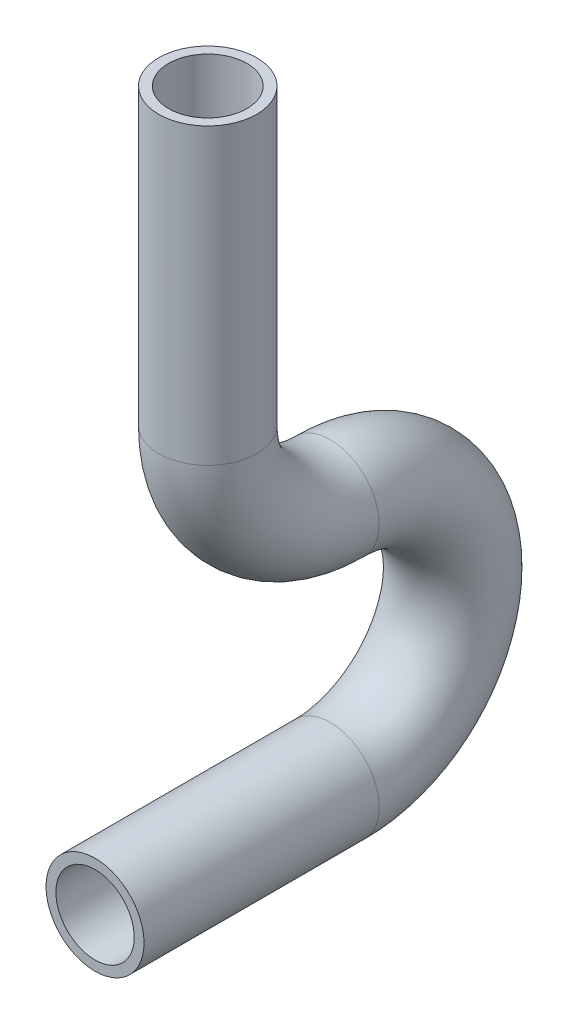
from build123d import *

# Parameters (mm, degrees)
SKETCH2_R           = 25
SKETCH2_R_2         = 20
BASE_EXTRUDE_DEPTH  = 120
SKETCH4_R           = 25
SKETCH4_R_2         = 20
SKETCH5_R           = 25
SKETCH5_R_2         = 20
SKETCH7_R           = 25
SKETCH7_R_2         = 20
BOSS_EXTRUDE1_DEPTH = 150


with BuildPart() as part:
    # Sketch2 → Base-Extrude (new body)
    with BuildSketch(Plane.XY):
        with Locations((-2.499935409, 0.01741759)):
            Circle(SKETCH2_R)
        with Locations((-2.499935409, 0.01741759)):
            Circle(SKETCH2_R_2, mode=Mode.SUBTRACT)
    extrude(amount=-BASE_EXTRUDE_DEPTH)

    # Boss-Sweep1: sweep along a path in Sketch3
    with BuildLine(Plane(origin=(0, 0, 0), x_dir=(0, 0, -1), z_dir=(1, 0, 0))) as boss_sweep1_path:
        ThreePointArc((120, 0.01741759), (182.5, 62.51741759), (120, 125.01741759))
    # Sketch4 → Boss-Sweep1 (sweep)
    with BuildSketch(Plane(origin=(0, 0, -120), x_dir=(-1, 0, 0), z_dir=(0, 0, -1))):
        with Locations((2.499935409, 0.01741759)):
            Circle(SKETCH4_R)
        with Locations((2.499935409, 0.01741759)):
            Circle(SKETCH4_R_2, mode=Mode.SUBTRACT)
    sweep(path=boss_sweep1_path.line)

    # Boss-Sweep2: sweep along a path in Sketch6
    with BuildLine(Plane(origin=(0, 0, 0), x_dir=(0, 0, -1), z_dir=(1, 0, 0))) as boss_sweep2_path:
        ThreePointArc((57.5, 187.51741759), (75.805826176, 143.323243766), (120, 125.01741759))
    # Sketch5 → Boss-Sweep2 (sweep)
    with BuildSketch(Plane.XY.offset(-120)):
        with Locations((-2.499935409, 125.01741759)):
            Circle(SKETCH5_R)
        with Locations((-2.499935409, 125.01741759)):
            Circle(SKETCH5_R_2, mode=Mode.SUBTRACT)
    sweep(path=boss_sweep2_path.line)

    # Sketch7 → Boss-Extrude1 (add)
    with BuildSketch(Plane(origin=(0, 187.51741759, 0), x_dir=(-1, 0, 0), z_dir=(0, 1, 0))):
        with Locations((2.499935409, -57.5)):
            Circle(SKETCH7_R)
        with Locations((2.499935409, -57.5)):
            Circle(SKETCH7_R_2, mode=Mode.SUBTRACT)
    extrude(amount=BOSS_EXTRUDE1_DEPTH)


solid = part.part
